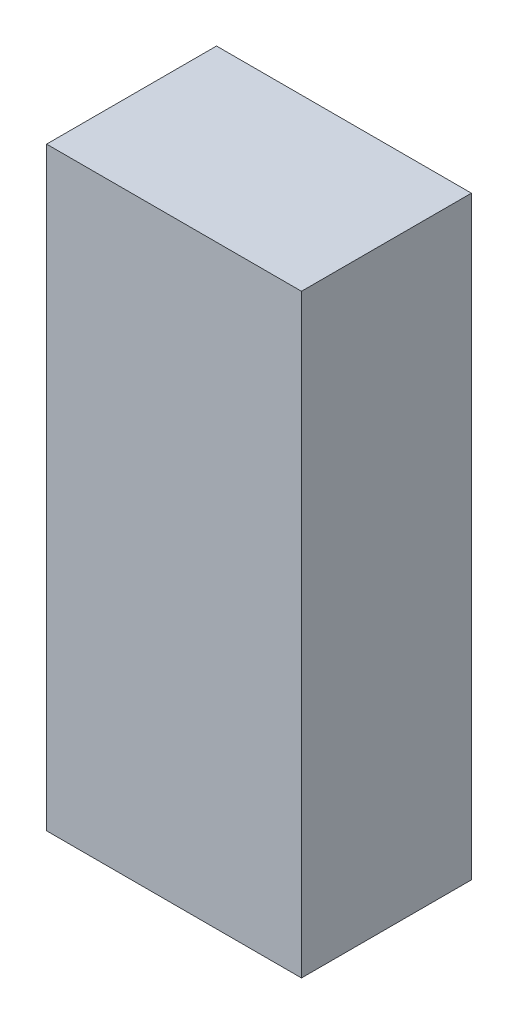
from build123d import *

# Parameters (mm, degrees)
SKETCH1_W           = 3
SKETCH1_H           = 2
BOSS_EXTRUDE1_DEPTH = 7


with BuildPart() as part:
    # Sketch1 → Boss-Extrude1 (new body)
    with BuildSketch(Plane(origin=(0, 0, 0), x_dir=(1, 0, 0), z_dir=(0, 1, 0))):
        Rectangle(SKETCH1_W, SKETCH1_H)
    extrude(amount=BOSS_EXTRUDE1_DEPTH)


solid = part.part
